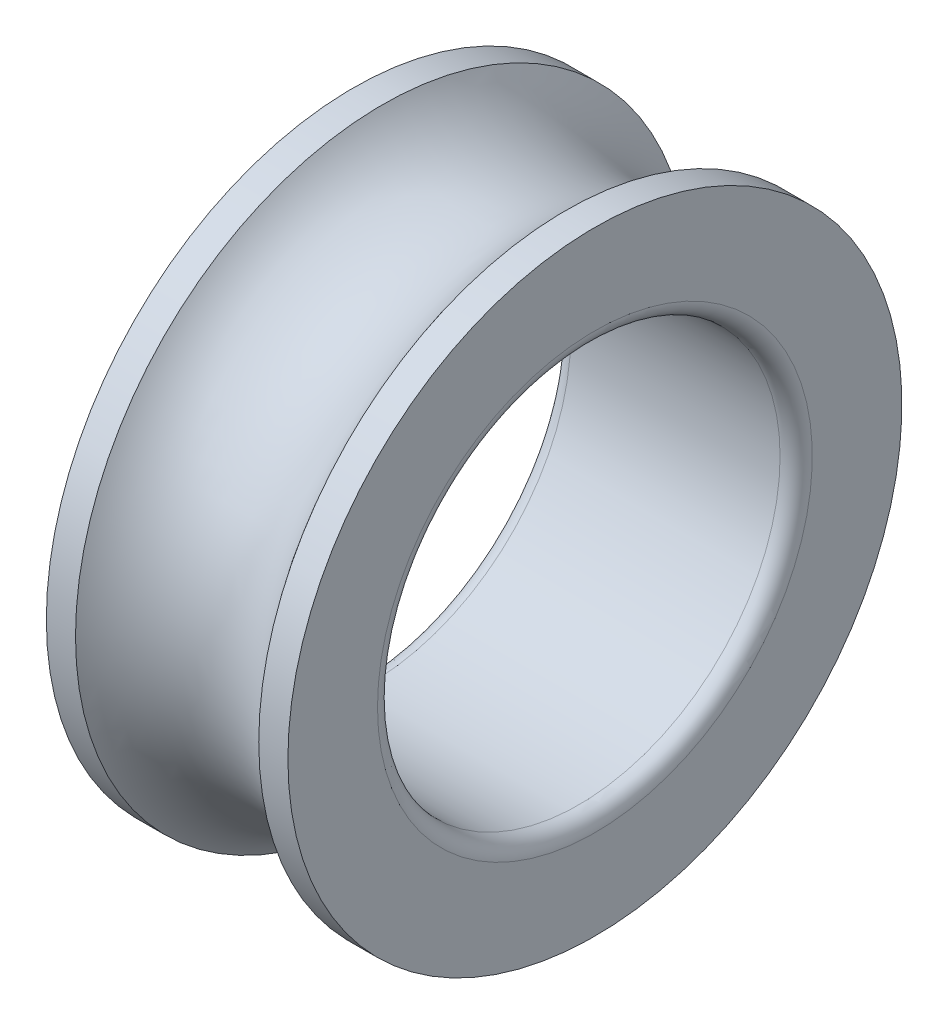
from build123d import *


with BuildPart() as part:
    # Sketch1 → Revolve1 (revolve)
    with BuildSketch(Plane.XY, mode=Mode.PRIVATE) as revolve1_sk:
        with BuildLine():
            Line((17.068172134, 57.19), (22.5, 57.19))
            Line((22.5, 57.19), (22.5, 40.5))
            ThreePointArc((22.5, 40.5), (21.621320344, 38.378679656), (19.5, 37.5))
            Line((19.5, 37.5), (-19.5, 37.5))
            ThreePointArc((-19.5, 37.5), (-21.621320344, 38.378679656), (-22.5, 40.5))
            Line((-22.5, 40.5), (-22.5, 57.19))
            Line((-22.5, 57.19), (-17.068172134, 57.19))
            ThreePointArc((-17.068172134, 57.19), (0, 48.24), (17.068172134, 57.19))
        make_face()
    revolve(revolve1_sk.sketch.rotate(Axis((-18.901112782, 0, 0), (1, 0, 0)), 90), axis=Axis((-18.901112782, 0, 0), (1, 0, 0)))


solid = part.part
